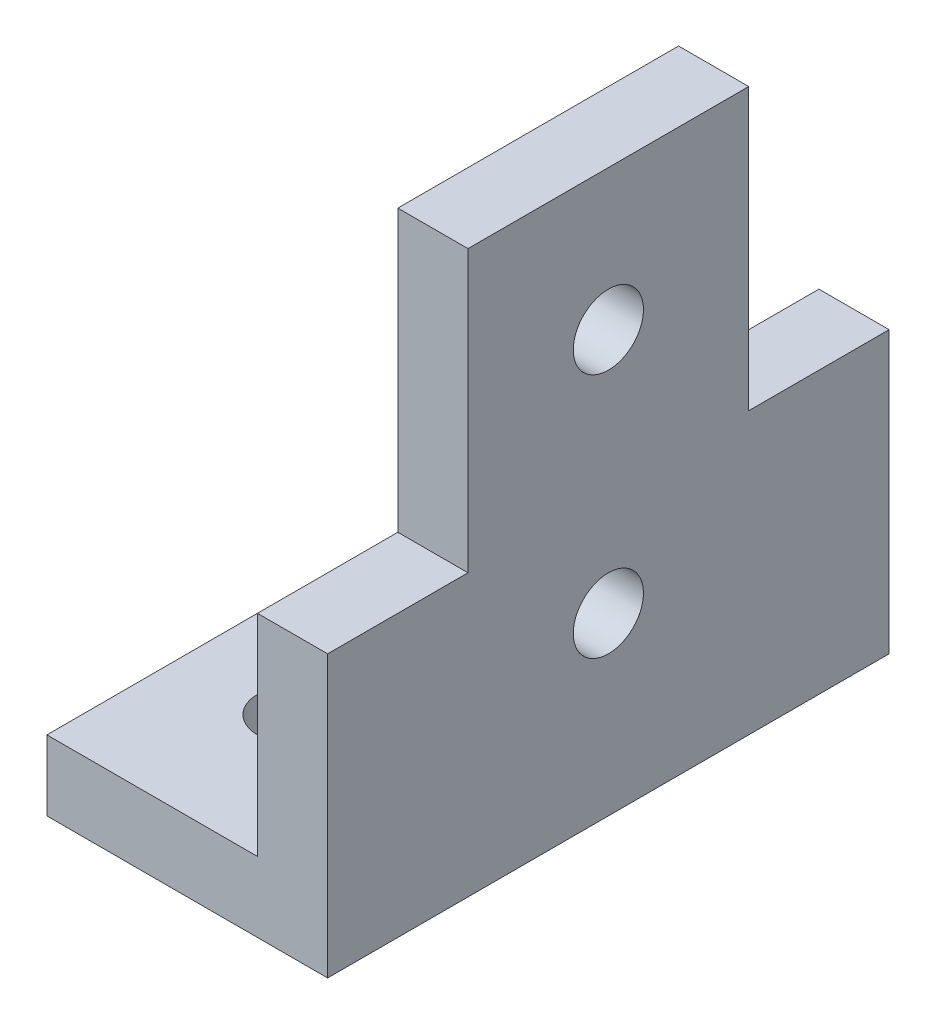
from build123d import *

# Parameters (mm, degrees)
BOSS_EXTRUDE1_DEPTH = 50.8
CUT_EXTRUDE1_REACH  = 61.906
SKETCH2_R           = 3.175
CUT_EXTRUDE2_REACH  = 61.906
SKETCH3_R           = 3.175
SKETCH4_W           = 25.4
SKETCH4_H           = 25.4
SKETCH4_R           = 3.175
BOSS_EXTRUDE2_DEPTH = 6.35


with BuildPart() as part:
    # Sketch1 → Boss-Extrude1 (new body)
    with BuildSketch(Plane.XY):
        Polygon((0, 0), (25.4, 0), (25.4, 16.852186277), (25.4, 25.4), (19.05, 25.4), (19.05, 6.35), (0, 6.35), align=None)
    extrude(amount=BOSS_EXTRUDE1_DEPTH)

    # Sketch2 → Cut-Extrude1 (cut, up to next)
    with BuildSketch(Plane(origin=(0, 6.35, 0), x_dir=(1, 0, 0), z_dir=(0, 1, 0)), mode=Mode.PRIVATE) as cut_extrude1_sk1:
        with Locations(Location((9.525, -12.7, 0), (0, 0, 180))):
            Circle(SKETCH2_R)
    cut_extrude1_tool1 = extrude(cut_extrude1_sk1.sketch, amount=-CUT_EXTRUDE1_REACH, mode=Mode.PRIVATE) & part.part
    # Sketch2 → Cut-Extrude1 (cut, up to next)
    with BuildSketch(Plane(origin=(0, 6.35, 0), x_dir=(1, 0, 0), z_dir=(0, 1, 0)), mode=Mode.PRIVATE) as cut_extrude1_sk2:
        with Locations(Location((9.525, -38.1, 0), (0, 0, 180))):
            Circle(SKETCH2_R)
    cut_extrude1_tool2 = extrude(cut_extrude1_sk2.sketch, amount=-CUT_EXTRUDE1_REACH, mode=Mode.PRIVATE) & part.part
    add(cut_extrude1_tool1.solids().sort_by_distance((9.525, 6.35, 12.7))[0], mode=Mode.SUBTRACT)
    add(cut_extrude1_tool2.solids().sort_by_distance((9.525, 6.35, 38.1))[0], mode=Mode.SUBTRACT)

    # Sketch3 → Cut-Extrude2 (cut, up to next)
    with BuildSketch(Plane.ZY.offset(-19.05), mode=Mode.PRIVATE) as cut_extrude2_sk1:
        with Locations((25.4, 15.875)):
            Circle(SKETCH3_R)
    cut_extrude2_tool1 = extrude(cut_extrude2_sk1.sketch, amount=-CUT_EXTRUDE2_REACH, mode=Mode.PRIVATE) & part.part
    add(cut_extrude2_tool1.solids().sort_by_distance((19.05, 15.875, 25.4))[0], mode=Mode.SUBTRACT)

    # Sketch4 → Boss-Extrude2 (add)
    with BuildSketch(Plane.ZY.offset(-19.05)):
        with Locations((25.4, 38.1)):
            Rectangle(SKETCH4_W, SKETCH4_H)
        with Locations((25.4, 38.1)):
            Circle(SKETCH4_R, mode=Mode.SUBTRACT)
    extrude(amount=-BOSS_EXTRUDE2_DEPTH)


solid = part.part
